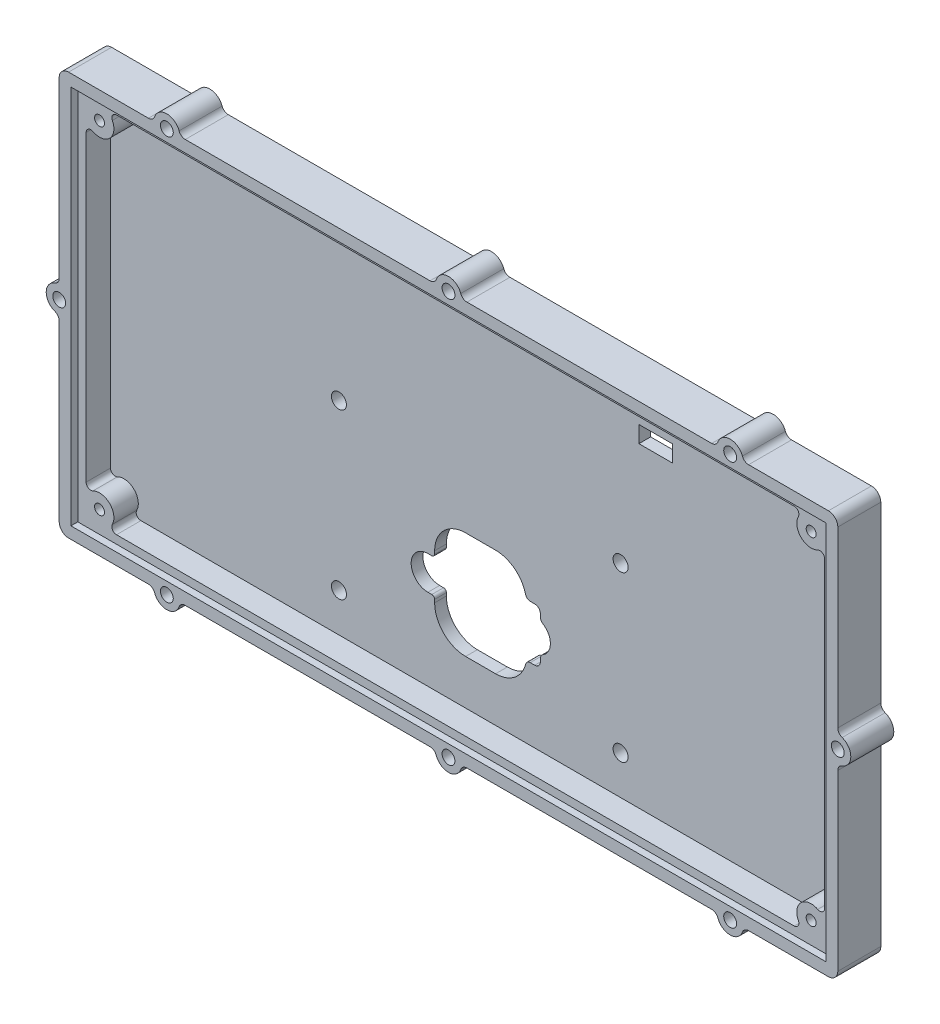
from build123d import *

# Parameters (mm, degrees)
SKETCH4_W           = 210.6422
SKETCH4_H           = 109.1692
SKETCH4_W_2         = 204.2922
SKETCH4_H_2         = 102.8192
BOSS_EXTRUDE1_DEPTH = 1.8542
SKETCH5_W           = 210.6422
SKETCH5_H           = 109.1692
SKETCH5_W_2         = 199.78624
SKETCH5_H_2         = 98.36404
BOSS_EXTRUDE2_DEPTH = 6.604
SKETCH6_W           = 210.6422
SKETCH6_H           = 109.1692
SKETCH6_W_2         = 9.05002
SKETCH6_H_2         = 4.50088
BOSS_EXTRUDE3_DEPTH = 3.175
SKETCH9_R           = 1.3462
BOSS_EXTRUDE4_DEPTH = 6.604
SKETCH9_2_R         = 1.3462
CUT_EXTRUDE3_DEPTH  = 9.779
CUT_EXTRUDE1_REACH  = 121.195
SKETCH10_R          = 2.032
CUT_EXTRUDE2_REACH  = 121.195
SKETCH11_R          = 1.7399
SKETCH11_3_R        = 1.7399
BOSS_EXTRUDE5_DEPTH = 11.6332
CUT_EXTRUDE4_REACH  = 122.846
SKETCH12_R          = 1.7399
SKETCH12_3_R        = 1.7399
BOSS_EXTRUDE6_DEPTH = 11.6332
FILLET1_R           = 2.54


with BuildPart() as part:
    # Sketch4 → Boss-Extrude1 (new body)
    with BuildSketch(Plane.XY):
        Rectangle(SKETCH4_W, SKETCH4_H)
        Rectangle(SKETCH4_W_2, SKETCH4_H_2, mode=Mode.SUBTRACT)
    extrude(amount=-BOSS_EXTRUDE1_DEPTH)

    # Sketch5 → Boss-Extrude2 (add)
    with BuildSketch(Plane(origin=(0, 0, -1.8542), x_dir=(-1, 0, 0), z_dir=(0, 0, -1))):
        Rectangle(SKETCH5_W, SKETCH5_H)
        Rectangle(SKETCH5_W_2, SKETCH5_H_2, mode=Mode.SUBTRACT)
    extrude(amount=BOSS_EXTRUDE2_DEPTH)

    # Sketch6 → Boss-Extrude3 (add)
    with BuildSketch(Plane(origin=(0, 0, -8.4582), x_dir=(-1, 0, 0), z_dir=(0, 0, -1))):
        Rectangle(SKETCH6_W, SKETCH6_H)
        with Locations((-47.58309, 38.46576)):
            Rectangle(SKETCH6_W_2, SKETCH6_H_2, mode=Mode.SUBTRACT)
        with BuildLine():
            Line((12.20978, -27.897836), (12.20978, -28.697936))
            ThreePointArc((12.20978, -28.697936), (9.75474904, -34.62490504), (3.82778, -37.079936))
            Line((3.82778, -37.079936), (-4.286513327, -37.079936))
            ThreePointArc((-4.286513327, -37.079936), (-9.435955354, -35.31164682), (-12.412717205, -30.752865327))
            ThreePointArc((-12.412717205, -30.752865327), (-12.871637448, -30.050048906), (-13.665514588, -29.777436))
            Line((-13.665514588, -29.777436), (-14.86662, -29.777436))
            ThreePointArc((-14.86662, -29.777436), (-15.944250735, -29.331066735), (-16.39062, -28.253436))
            Line((-16.39062, -28.253436), (-16.39062, -27.421857371))
            ThreePointArc((-16.39062, -27.421857371), (-16.569977638, -26.738606142), (-17.061799901, -26.231543753))
            ThreePointArc((-17.061799901, -26.231543753), (-19.10842, -22.601936), (-17.061799901, -18.972328247))
            ThreePointArc((-17.061799901, -18.972328247), (-16.569977638, -18.465265858), (-16.39062, -17.782014629))
            Line((-16.39062, -17.782014629), (-16.39062, -16.950436))
            ThreePointArc((-16.39062, -16.950436), (-15.944250735, -15.872805265), (-14.86662, -15.426436))
            Line((-14.86662, -15.426436), (-13.665514588, -15.426436))
            ThreePointArc((-13.665514588, -15.426436), (-12.871637448, -15.153823094), (-12.412717205, -14.451006673))
            ThreePointArc((-12.412717205, -14.451006673), (-9.435955354, -9.89222518), (-4.286513327, -8.123936))
            Line((-4.286513327, -8.123936), (3.82778, -8.123936))
            ThreePointArc((3.82778, -8.123936), (9.75474904, -10.57896696), (12.20978, -16.505936))
            Line((12.20978, -16.505936), (12.20978, -17.306036))
            ThreePointArc((12.20978, -17.306036), (12.432964633, -17.844851367), (12.97178, -18.068036))
            Line((12.97178, -18.068036), (14.02588, -18.068036))
            ThreePointArc((14.02588, -18.068036), (18.55978, -22.601936), (14.02588, -27.135836))
            Line((14.02588, -27.135836), (12.97178, -27.135836))
            ThreePointArc((12.97178, -27.135836), (12.432964633, -27.359020633), (12.20978, -27.897836))
        make_face(mode=Mode.SUBTRACT)
    extrude(amount=BOSS_EXTRUDE3_DEPTH)

    # Sketch9 → Boss-Extrude4 (add)
    # profile 1 of 4: a face of its own
    with BuildSketch(Plane.XY.offset(-1.8542)):
        with BuildLine():
            Line((-99.89312, 40.967776799), (-99.89312, 49.18202))
            Line((-99.89312, 49.18202), (-91.678876799, 49.18202))
            ThreePointArc((-91.678876799, 49.18202), (-92.763086245, 48.573374577), (-92.808084484, 47.330822956))
            ThreePointArc((-92.808084484, 47.330822956), (-93.515501627, 42.804401627), (-98.041922956, 42.096984484))
            ThreePointArc((-98.041922956, 42.096984484), (-99.284474577, 42.051986245), (-99.89312, 40.967776799))
        make_face()
        with Locations((-96.26346, 45.55236)):
            Circle(SKETCH9_R, mode=Mode.SUBTRACT)
    # profile 2 of 4: a face of its own
    with BuildSketch(Plane.XY.offset(-1.8542)):
        with BuildLine():
            Line((-99.89312, -40.967776799), (-99.89312, -49.18202))
            Line((-99.89312, -49.18202), (-91.678876799, -49.18202))
            ThreePointArc((-91.678876799, -49.18202), (-92.763086245, -48.573374577), (-92.808084484, -47.330822956))
            ThreePointArc((-92.808084484, -47.330822956), (-93.515501627, -42.804401627), (-98.041922956, -42.096984484))
            ThreePointArc((-98.041922956, -42.096984484), (-99.284474577, -42.051986245), (-99.89312, -40.967776799))
        make_face()
        with Locations((-96.26346, -45.55236)):
            Circle(SKETCH9_R, mode=Mode.SUBTRACT)
    # profile 3 of 4: a face of its own
    with BuildSketch(Plane.XY.offset(-1.8542)):
        with BuildLine():
            Line((99.89312, -40.967776799), (99.89312, -49.18202))
            Line((99.89312, -49.18202), (91.678876799, -49.18202))
            ThreePointArc((91.678876799, -49.18202), (92.763086245, -48.573374577), (92.808084484, -47.330822956))
            ThreePointArc((92.808084484, -47.330822956), (93.515501627, -42.804401627), (98.041922956, -42.096984484))
            ThreePointArc((98.041922956, -42.096984484), (99.284474577, -42.051986245), (99.89312, -40.967776799))
        make_face()
        with Locations((96.26346, -45.55236)):
            Circle(SKETCH9_R, mode=Mode.SUBTRACT)
    # profile 4 of 4: a face of its own
    with BuildSketch(Plane.XY.offset(-1.8542)):
        with BuildLine():
            Line((91.678876799, 49.18202), (99.89312, 49.18202))
            Line((99.89312, 49.18202), (99.89312, 40.967776799))
            ThreePointArc((99.89312, 40.967776799), (99.284474577, 42.051986245), (98.041922956, 42.096984484))
            ThreePointArc((98.041922956, 42.096984484), (93.515501627, 42.804401627), (92.808084484, 47.330822956))
            ThreePointArc((92.808084484, 47.330822956), (92.763086245, 48.573374577), (91.678876799, 49.18202))
        make_face()
        with Locations((96.26346, 45.55236)):
            Circle(SKETCH9_R, mode=Mode.SUBTRACT)
    extrude(amount=-BOSS_EXTRUDE4_DEPTH)

    # Sketch9<2> → Cut-Extrude3 (cut)
    with BuildSketch(Plane.XY.offset(-1.8542)):
        with Locations((-96.26346, 45.55236)):
            Circle(SKETCH9_2_R)
        with Locations((-96.26346, -45.55236)):
            Circle(SKETCH9_2_R)
        with Locations((96.26346, -45.55236)):
            Circle(SKETCH9_2_R)
        with Locations((96.26346, 45.55236)):
            Circle(SKETCH9_2_R)
    extrude(amount=-CUT_EXTRUDE3_DEPTH, mode=Mode.SUBTRACT)

    # Sketch10 → Cut-Extrude1 (cut, up to next)
    with BuildSketch(Plane(origin=(0, 0, -11.6332), x_dir=(-1, 0, 0), z_dir=(0, 0, -1)), mode=Mode.PRIVATE) as cut_extrude1_sk1:
        with Locations((-38.1, 5.7404)):
            Circle(SKETCH10_R)
    cut_extrude1_tool1 = extrude(cut_extrude1_sk1.sketch, amount=-CUT_EXTRUDE1_REACH, mode=Mode.PRIVATE) & part.part
    # Sketch10 → Cut-Extrude1 (cut, up to next)
    with BuildSketch(Plane(origin=(0, 0, -11.6332), x_dir=(-1, 0, 0), z_dir=(0, 0, -1)), mode=Mode.PRIVATE) as cut_extrude1_sk2:
        with Locations((-38.1, -38.7096)):
            Circle(SKETCH10_R)
    cut_extrude1_tool2 = extrude(cut_extrude1_sk2.sketch, amount=-CUT_EXTRUDE1_REACH, mode=Mode.PRIVATE) & part.part
    # Sketch10 → Cut-Extrude1 (cut, up to next)
    with BuildSketch(Plane(origin=(0, 0, -11.6332), x_dir=(-1, 0, 0), z_dir=(0, 0, -1)), mode=Mode.PRIVATE) as cut_extrude1_sk3:
        with Locations((38.1, -38.7096)):
            Circle(SKETCH10_R)
    cut_extrude1_tool3 = extrude(cut_extrude1_sk3.sketch, amount=-CUT_EXTRUDE1_REACH, mode=Mode.PRIVATE) & part.part
    # Sketch10 → Cut-Extrude1 (cut, up to next)
    with BuildSketch(Plane(origin=(0, 0, -11.6332), x_dir=(-1, 0, 0), z_dir=(0, 0, -1)), mode=Mode.PRIVATE) as cut_extrude1_sk4:
        with Locations((38.1, 5.7404)):
            Circle(SKETCH10_R)
    cut_extrude1_tool4 = extrude(cut_extrude1_sk4.sketch, amount=-CUT_EXTRUDE1_REACH, mode=Mode.PRIVATE) & part.part
    add(cut_extrude1_tool1.solids().sort_by_distance((38.1, 5.7404, -11.6332))[0], mode=Mode.SUBTRACT)
    add(cut_extrude1_tool2.solids().sort_by_distance((38.1, -38.7096, -11.6332))[0], mode=Mode.SUBTRACT)
    add(cut_extrude1_tool3.solids().sort_by_distance((-38.1, -38.7096, -11.6332))[0], mode=Mode.SUBTRACT)
    add(cut_extrude1_tool4.solids().sort_by_distance((-38.1, 5.7404, -11.6332))[0], mode=Mode.SUBTRACT)

    # Sketch11 → Cut-Extrude2 (cut, up to next)
    with BuildSketch(Plane.XY, mode=Mode.PRIVATE) as cut_extrude2_sk1:
        with Locations((-76.2, 54.5846)):
            Circle(SKETCH11_R)
    cut_extrude2_tool1 = extrude(cut_extrude2_sk1.sketch, amount=-CUT_EXTRUDE2_REACH, mode=Mode.PRIVATE) & part.part
    # Sketch11 → Cut-Extrude2 (cut, up to next)
    with BuildSketch(Plane.XY, mode=Mode.PRIVATE) as cut_extrude2_sk2:
        with Locations((0, 54.5846)):
            Circle(SKETCH11_R)
    cut_extrude2_tool2 = extrude(cut_extrude2_sk2.sketch, amount=-CUT_EXTRUDE2_REACH, mode=Mode.PRIVATE) & part.part
    # Sketch11 → Cut-Extrude2 (cut, up to next)
    with BuildSketch(Plane.XY, mode=Mode.PRIVATE) as cut_extrude2_sk3:
        with Locations((76.2, 54.5846)):
            Circle(SKETCH11_R)
    cut_extrude2_tool3 = extrude(cut_extrude2_sk3.sketch, amount=-CUT_EXTRUDE2_REACH, mode=Mode.PRIVATE) & part.part
    cut_extrude2_1 = cut_extrude2_tool1.solids().sort_by_distance((-76.2, 54.5846, 0))[0]
    add(cut_extrude2_1, mode=Mode.SUBTRACT)
    cut_extrude2_2 = cut_extrude2_tool2.solids().sort_by_distance((0, 54.5846, 0))[0]
    add(cut_extrude2_2, mode=Mode.SUBTRACT)
    cut_extrude2_3 = cut_extrude2_tool3.solids().sort_by_distance((76.2, 54.5846, 0))[0]
    add(cut_extrude2_3, mode=Mode.SUBTRACT)
    cut_extrude2 = cut_extrude2_1 + cut_extrude2_2 + cut_extrude2_3  # Cut-Extrude2 as one shape, for the pattern or mirror that repeats it

    # Sketch11<3> → Boss-Extrude5 (add)
    # profile 1 of 3: a face of its own
    with BuildSketch(Plane.XY):
        with BuildLine():
            Line((-4.988514088, 54.5846), (-4.988514088, 51.5366))
            Line((-4.988514088, 51.5366), (4.988514088, 51.5366))
            Line((4.988514088, 51.5366), (4.988514088, 54.5846))
            ThreePointArc((4.988514088, 54.5846), (3.963833248, 54.909564152), (3.313713195, 55.765669544))
            ThreePointArc((3.313713195, 55.765669544), (0, 58.1025), (-3.313713195, 55.765669544))
            ThreePointArc((-3.313713195, 55.765669544), (-3.963833248, 54.909564152), (-4.988514088, 54.5846))
        make_face()
        with Locations((0, 54.5846)):
            Circle(SKETCH11_3_R, mode=Mode.SUBTRACT)
    # profile 2 of 3: a face of its own
    with BuildSketch(Plane.XY):
        with BuildLine():
            Line((71.211485912, 54.5846), (71.211485912, 51.5366))
            Line((71.211485912, 51.5366), (81.188514088, 51.5366))
            Line((81.188514088, 51.5366), (81.188514088, 54.5846))
            ThreePointArc((81.188514088, 54.5846), (80.163833248, 54.909564152), (79.513713195, 55.765669544))
            ThreePointArc((79.513713195, 55.765669544), (76.2, 58.1025), (72.886286805, 55.765669544))
            ThreePointArc((72.886286805, 55.765669544), (72.236166752, 54.909564152), (71.211485912, 54.5846))
        make_face()
        with Locations((76.2, 54.5846)):
            Circle(SKETCH11_3_R, mode=Mode.SUBTRACT)
    # profile 3 of 3: a face of its own
    with BuildSketch(Plane.XY):
        with BuildLine():
            Line((-71.211485912, 54.5846), (-71.211485912, 51.5366))
            Line((-71.211485912, 51.5366), (-81.188514088, 51.5366))
            Line((-81.188514088, 51.5366), (-81.188514088, 54.5846))
            ThreePointArc((-81.188514088, 54.5846), (-80.163833248, 54.909564152), (-79.513713195, 55.765669544))
            ThreePointArc((-79.513713195, 55.765669544), (-76.2, 58.1025), (-72.886286805, 55.765669544))
            ThreePointArc((-72.886286805, 55.765669544), (-72.236166752, 54.909564152), (-71.211485912, 54.5846))
        make_face()
        with Locations((-76.2, 54.5846)):
            Circle(SKETCH11_3_R, mode=Mode.SUBTRACT)
    boss_extrude5 = extrude(amount=-BOSS_EXTRUDE5_DEPTH)

    # Mirror1: Cut-Extrude2, Boss-Extrude5 across plane
    add(cut_extrude2.mirror(Plane.ZX), mode=Mode.SUBTRACT)
    add(boss_extrude5.mirror(Plane.ZX))

    # Sketch12 → Cut-Extrude4 (cut, up to next)
    with BuildSketch(Plane.XY, mode=Mode.PRIVATE) as cut_extrude4_sk1:
        with Locations((-105.3211, 0)):
            Circle(SKETCH12_R)
    cut_extrude4_tool1 = extrude(cut_extrude4_sk1.sketch, amount=-CUT_EXTRUDE4_REACH, mode=Mode.PRIVATE) & part.part
    cut_extrude4 = cut_extrude4_tool1.solids().sort_by_distance((-105.3211, 0, 0))[0]
    add(cut_extrude4, mode=Mode.SUBTRACT)

    # Sketch12<3> → Boss-Extrude6 (add)
    with BuildSketch(Plane.XY):
        with BuildLine():
            Line((-105.3211, 4.988514088), (-102.2731, 4.988514088))
            Line((-102.2731, 4.988514088), (-102.2731, -4.988514088))
            Line((-102.2731, -4.988514088), (-105.3211, -4.988514088))
            ThreePointArc((-105.3211, -4.988514088), (-105.646064152, -3.963833248), (-106.502169544, -3.313713195))
            ThreePointArc((-106.502169544, -3.313713195), (-108.839, 0), (-106.502169544, 3.313713195))
            ThreePointArc((-106.502169544, 3.313713195), (-105.646064152, 3.963833248), (-105.3211, 4.988514088))
        make_face()
        with Locations((-105.3211, 0)):
            Circle(SKETCH12_3_R, mode=Mode.SUBTRACT)
    boss_extrude6 = extrude(amount=-BOSS_EXTRUDE6_DEPTH)

    # Mirror2: Cut-Extrude4, Boss-Extrude6 across plane
    add(cut_extrude4.mirror(Plane(origin=(0, 0, 0), x_dir=(0, 0, 1), z_dir=(1, 0, 0))), mode=Mode.SUBTRACT)
    add(boss_extrude6.mirror(Plane(origin=(0, 0, 0), x_dir=(0, 0, 1), z_dir=(1, 0, 0))))

    # Fillet1
    fillet1_edges = [part.edges().sort_by_distance(p)[0] for p in [
        (-105.3211, -54.5846, -5.8166),
        (105.3211, -54.5846, -5.8166),
        (105.3211, 54.5846, -5.8166),
        (-105.3211, 54.5846, -5.8166),
    ]]
    fillet(fillet1_edges, radius=FILLET1_R)


solid = part.part
